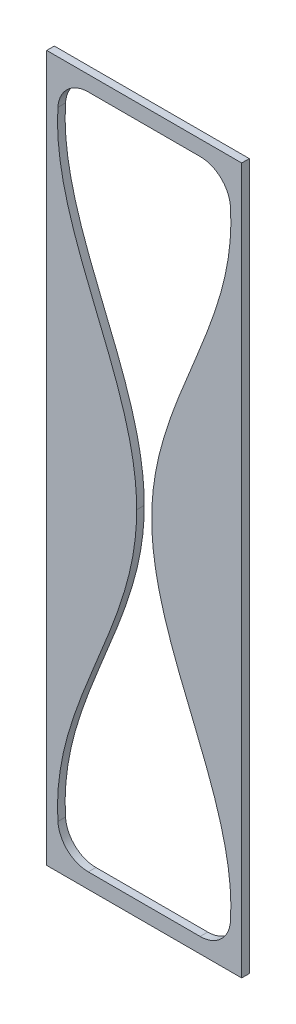
from build123d import *

# Parameters (mm, degrees)
BOSS_EXTRUDE1_DEPTH = 3.175
FILLET1_R           = 12.7


with BuildPart() as part:
    # Sketch1 → Boss-Extrude1 (new body)
    with BuildSketch(Plane.XY):
        with BuildLine():
            Line((34.35, 6.35), (0, 6.35))
            Line((0, 6.35), (0, 0))
            Line((0, 0), (40.7, 0))
            Line((40.7, 0), (40.7, 147.32))
            Line((40.7, 147.32), (3.175, 147.32))
            add(Edge.make_bspline(
                [(34.35, 6.35), (45.415498484, 56.545116153), (2.852403288, 97.787684056), (3.175, 147.32)],
                knots=[0, 0, 0, 0, 1, 1, 1, 1], degree=3))
        make_face()
    extrude(amount=BOSS_EXTRUDE1_DEPTH)

    # Mirror1: part across plane


with BuildPart() as part_1:
    add(part.part)
    add(part.part.mirror(Plane(origin=(0, 0, 3.175), x_dir=(0, 0, 1), z_dir=(-1, 0, 0))))

    # Mirror2: part across plane


with BuildPart() as part_2:
    add(part_1.part)
    add(part_1.part.mirror(Plane(origin=(-3.175, 147.32, 3.175), x_dir=(0, 0, 1), z_dir=(0, 1, 0))))

    # Fillet1
    fillet1_edges = [part_2.edges().sort_by_distance(p)[0] for p in [
        (34.35, 6.35, 1.5875),
        (-34.35, 6.35, 1.5875),
        (34.35, 288.29, 1.5875),
        (-34.35, 288.29, 1.5875),
    ]]
    fillet(fillet1_edges, radius=FILLET1_R)


solid = part_2.part
